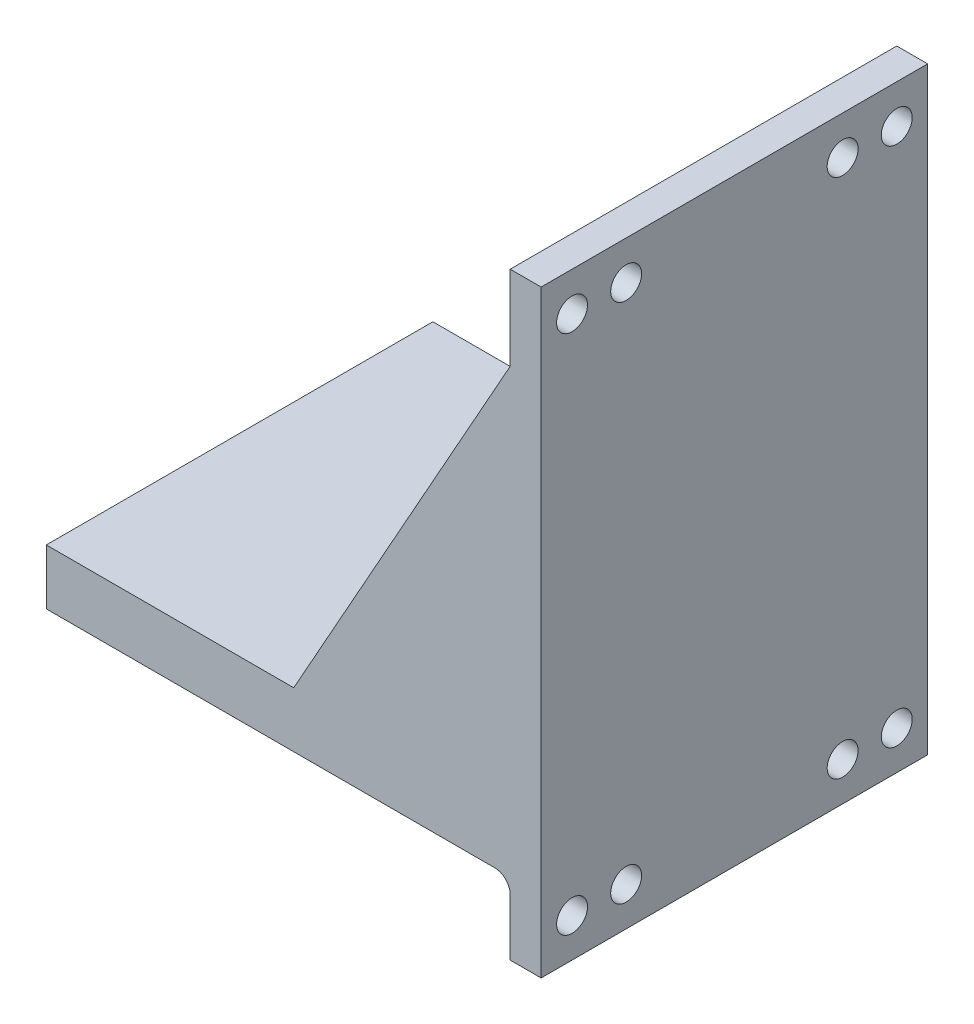
from build123d import *

# Parameters (mm, degrees)
SKETCH1_W           = 50
SKETCH1_H           = 77.4
SKETCH1_R           = 2
BOSS_EXTRUDE1_DEPTH = 4
SKETCH2_W           = 50
SKETCH2_H           = 7.168288369
BOSS_EXTRUDE2_DEPTH = 60
SKETCH6_W           = 20
SKETCH6_H           = 26
CUT_EXTRUDE1_DEPTH  = 124.730240351
RIB1_REACH          = 97.821
SKETCH7_WALL_W      = 250.948466038
SKETCH7_WALL_H      = 14
FILLET2_R           = 2
FILLET3_R           = 12
SKETCH8_W           = 13
SKETCH8_H           = 7.168288369
BOSS_EXTRUDE3_DEPTH = 20
FILLET4_R           = 4
BOSS_EXTRUDE4_DEPTH = 6
FILLET5_R           = 2


with BuildPart() as part:
    # Sketch1 → Boss-Extrude1 (new body)
    with BuildSketch(Plane.ZY.offset(8)):
        with Locations((55.110705908, 0)):
            Rectangle(SKETCH1_W, SKETCH1_H)
        with Locations((34.110705908, 33.7)):
            Circle(SKETCH1_R, mode=Mode.SUBTRACT)
        with Locations((41.110705908, 33.7)):
            Circle(SKETCH1_R, mode=Mode.SUBTRACT)
        with Locations((69.110705908, 33.7)):
            Circle(SKETCH1_R, mode=Mode.SUBTRACT)
        with Locations((76.110705908, 33.7)):
            Circle(SKETCH1_R, mode=Mode.SUBTRACT)
        with Locations(Location((34.110705908, -33.7, 0), (0, 0, 180))):
            Circle(SKETCH1_R, mode=Mode.SUBTRACT)
        with Locations(Location((41.110705908, -33.7, 0), (0, 0, 180))):
            Circle(SKETCH1_R, mode=Mode.SUBTRACT)
        with Locations(Location((69.110705908, -33.7, 0), (0, 0, 180))):
            Circle(SKETCH1_R, mode=Mode.SUBTRACT)
        with Locations(Location((76.110705908, -33.7, 0), (0, 0, 180))):
            Circle(SKETCH1_R, mode=Mode.SUBTRACT)
    extrude(amount=BOSS_EXTRUDE1_DEPTH)

    # Sketch2 → Boss-Extrude2 (add)
    with BuildSketch(Plane.ZY.offset(12)):
        with Locations((55.110705908, -25.772954127)):
            Rectangle(SKETCH2_W, SKETCH2_H)
    extrude(amount=BOSS_EXTRUDE2_DEPTH)

    # Sketch6 → Cut-Extrude1 (cut, through all)
    with BuildSketch(Plane(origin=(0, -22.188809942, 0), x_dir=(1, 0, 0), z_dir=(0, 1, 0))):
        with Locations((-22, -43.110705908)):
            Rectangle(SKETCH6_W, SKETCH6_H)
    extrude(amount=-CUT_EXTRUDE1_DEPTH, mode=Mode.SUBTRACT)

    # Sketch7 wall → Rib1 (add, up to next)
    with BuildSketch(Plane(origin=(-26, 2.811190058, 80.110705908), x_dir=(0.488603368932, 0.87250601595, 0), z_dir=(-0.87250601595, 0.488603368932, 0)), mode=Mode.PRIVATE) as rib1_sk1:
        with Locations((0, 7)):
            Rectangle(SKETCH7_WALL_W, SKETCH7_WALL_H)
    rib1_tool1 = extrude(rib1_sk1.sketch, amount=-RIB1_REACH, mode=Mode.PRIVATE) - part.part
    add(rib1_tool1.solids().sort_by_distance((-26, 2.811190058, 80.110705908))[0])

    # Fillet2
    fillet2_edges = [part.edges().sort_by_distance(p)[0] for p in [
        (-12, -29.357098311, 68.110705908),
    ]]
    fillet(fillet2_edges, radius=FILLET2_R)

    # Fillet3
    fillet3_edges = [part.edges().sort_by_distance(p)[0] for p in [
        (-32, -25.772954126, 56.110705908),
    ]]
    fillet(fillet3_edges, radius=FILLET3_R)

    # Sketch8 → Boss-Extrude3 (add)
    with BuildSketch(Plane(origin=(-32, 0, 0), x_dir=(0, 0, -1), z_dir=(1, 0, 0))):
        with Locations((-36.610705908, -25.772954127)):
            Rectangle(SKETCH8_W, SKETCH8_H)
    extrude(amount=BOSS_EXTRUDE3_DEPTH)

    # Fillet4
    fillet4_edges = [part.edges().sort_by_distance(p)[0] for p in [
        (-32, -25.772954126, 43.110705908),
    ]]
    fillet(fillet4_edges, radius=FILLET4_R)

    # Sketch9 → Boss-Extrude4 (add)
    with BuildSketch(Plane(origin=(0, 0, 30.110705908), x_dir=(-1, 0, 0), z_dir=(0, 0, -1))):
        Polygon((42, -22.188809942), (12, 27.811190058), (12, -22.188809942), align=None)
    extrude(amount=-BOSS_EXTRUDE4_DEPTH)

    # Fillet5
    fillet5_edges = [part.edges().sort_by_distance(p)[0] for p in [
        (-12, -29.357098311, 36.610705908),
    ]]
    fillet(fillet5_edges, radius=FILLET5_R)


solid = part.part
